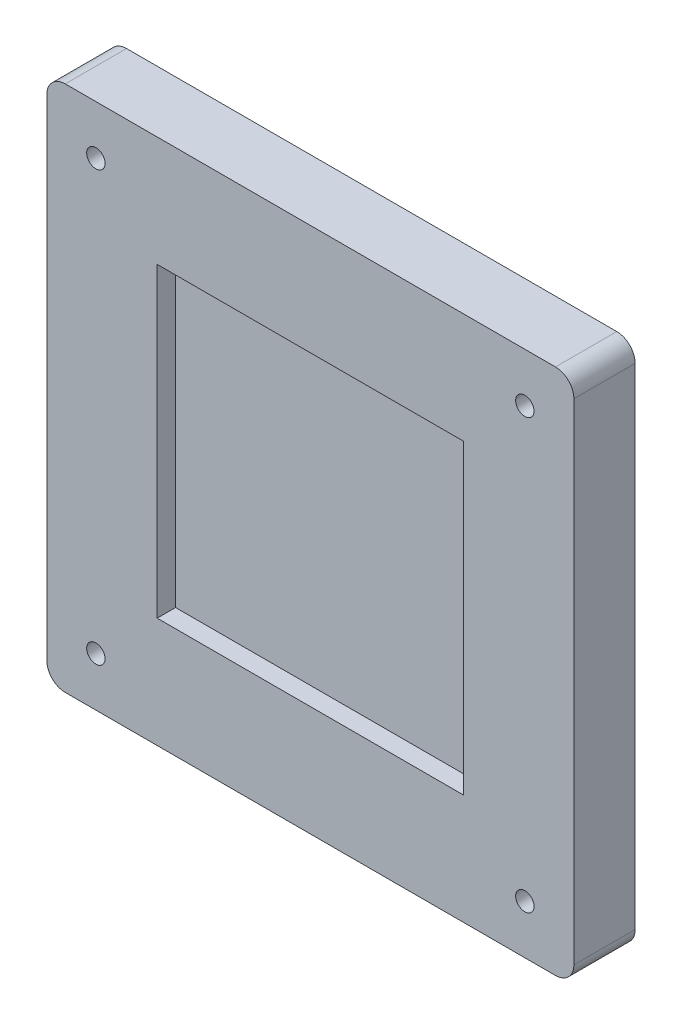
from build123d import *

# Parameters (mm, degrees)
EXTRUDE_1_DEPTH     = 10
SKETCH_2_W          = 50
SKETCH_2_H          = 50
CUT_EXTRUDE_1_DEPTH = 3
SKETCH_3_R          = 1.5
CUT_EXTRUDE_2_DEPTH = 87


with BuildPart() as part:
    # 草图1 → 凸台-拉伸1 (new body)
    with BuildSketch(Plane.XY):
        with BuildLine():
            Line((-40, -43), (40, -43))
            ThreePointArc((40, -43), (42.121320344, -42.121320344), (43, -40))
            Line((43, -40), (43, 40))
            ThreePointArc((43, 40), (42.121320344, 42.121320344), (40, 43))
            Line((40, 43), (-40, 43))
            ThreePointArc((-40, 43), (-42.121320344, 42.121320344), (-43, 40))
            Line((-43, 40), (-43, -40))
            ThreePointArc((-43, -40), (-42.121320344, -42.121320344), (-40, -43))
        make_face()
    extrude(amount=EXTRUDE_1_DEPTH)

    # 草图2 → 切除-拉伸1 (cut)
    with BuildSketch(Plane.XY.offset(10)):
        Rectangle(SKETCH_2_W, SKETCH_2_H)
    extrude(amount=-CUT_EXTRUDE_1_DEPTH, mode=Mode.SUBTRACT)

    # 草图3 → 切除-拉伸2 (cut, symmetric)
    with BuildSketch(Plane.XY.offset(10)):
        with Locations((-35, -35)):
            Circle(SKETCH_3_R)
        with Locations((-35, 35)):
            Circle(SKETCH_3_R)
        with Locations((35, -35)):
            Circle(SKETCH_3_R)
        with Locations((35, 35)):
            Circle(SKETCH_3_R)
    extrude(amount=CUT_EXTRUDE_2_DEPTH, both=True, mode=Mode.SUBTRACT)


solid = part.part
